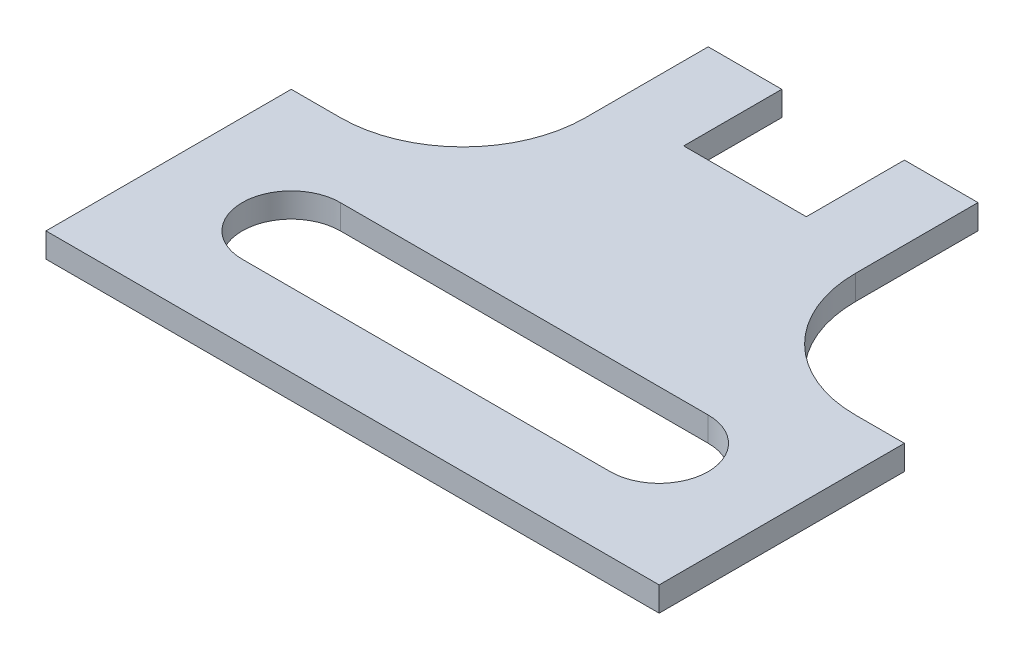
from build123d import *

# Parameters (mm, degrees)
BOSS_EXTRUDE1_DEPTH = 1


with BuildPart() as part:
    # Sketch1 → Boss-Extrude1 (new body)
    with BuildSketch(Plane(origin=(0, 0, 0), x_dir=(1, 0, 0), z_dir=(0, 1, 0))):
        with BuildLine():
            Line((0, 0), (25, 0))
            Line((25, 0), (25, 10))
            Line((25, 10), (23, 10))
            ThreePointArc((23, 10), (19.464466094, 11.464466094), (18, 15))
            Line((18, 15), (18, 20))
            Line((18, 20), (15, 20))
            Line((15, 20), (15, 16))
            Line((15, 16), (10, 16))
            Line((10, 16), (10, 20))
            Line((10, 20), (7, 20))
            Line((7, 20), (7, 15))
            ThreePointArc((7, 15), (5.535533906, 11.464466094), (2, 10))
            Line((2, 10), (0, 10))
            Line((0, 10), (0, 0))
        make_face()
        with BuildLine():
            Line((5, 7), (20, 7))
            ThreePointArc((20, 7), (22, 5), (20, 3))
            Line((20, 3), (5, 3))
            ThreePointArc((5, 3), (3, 5), (5, 7))
        make_face(mode=Mode.SUBTRACT)
    extrude(amount=BOSS_EXTRUDE1_DEPTH)


solid = part.part
